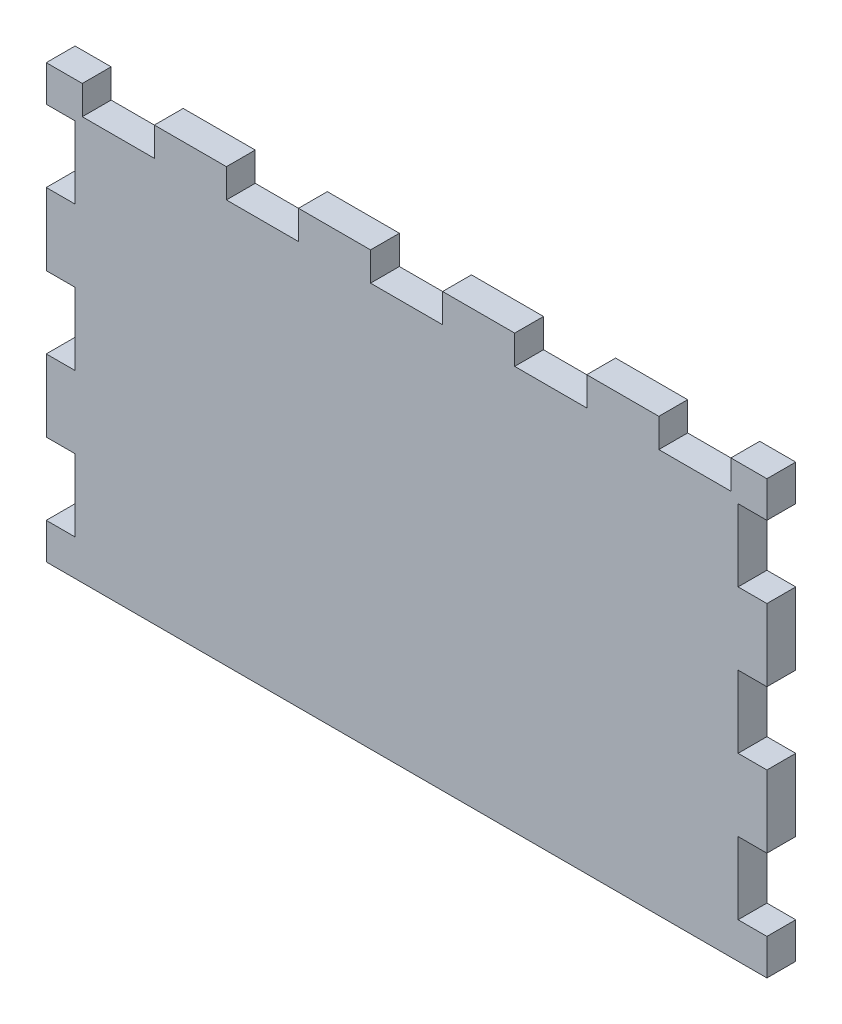
from build123d import *

# Parameters (mm, degrees)
BOSS_EXTRUDE1_DEPTH = 4


with BuildPart() as part:
    # Sketch1 → Boss-Extrude1 (new body)
    with BuildSketch(Plane.XY):
        Polygon((-45, 30), (-50, 30), (-50, 25), (-46, 25), (-46, 15), (-50, 15), (-50, 10), (-50, 5), (-46, 5), (-46, -5), (-50, -5), (-50, -10), (-50, -15), (-46, -15), (-46, -25), (-50, -25), (-50, -30), (50, -30), (50, -25), (46, -25), (46, -15), (50, -15), (50, -10), (50, -5), (46, -5), (46, 5), (50, 5), (50, 10), (50, 15), (46, 15), (46, 25), (50, 25), (50, 30), (45, 30), (45, 26), (35, 26), (35, 30), (30, 30), (25, 30), (25, 26), (15, 26), (15, 30), (10, 30), (5, 30), (5, 26), (-5, 26), (-5, 30), (-10, 30), (-15, 30), (-15, 26), (-25, 26), (-25, 30), (-30, 30), (-35, 30), (-35, 26), (-45, 26), align=None)
    extrude(amount=BOSS_EXTRUDE1_DEPTH)


solid = part.part
